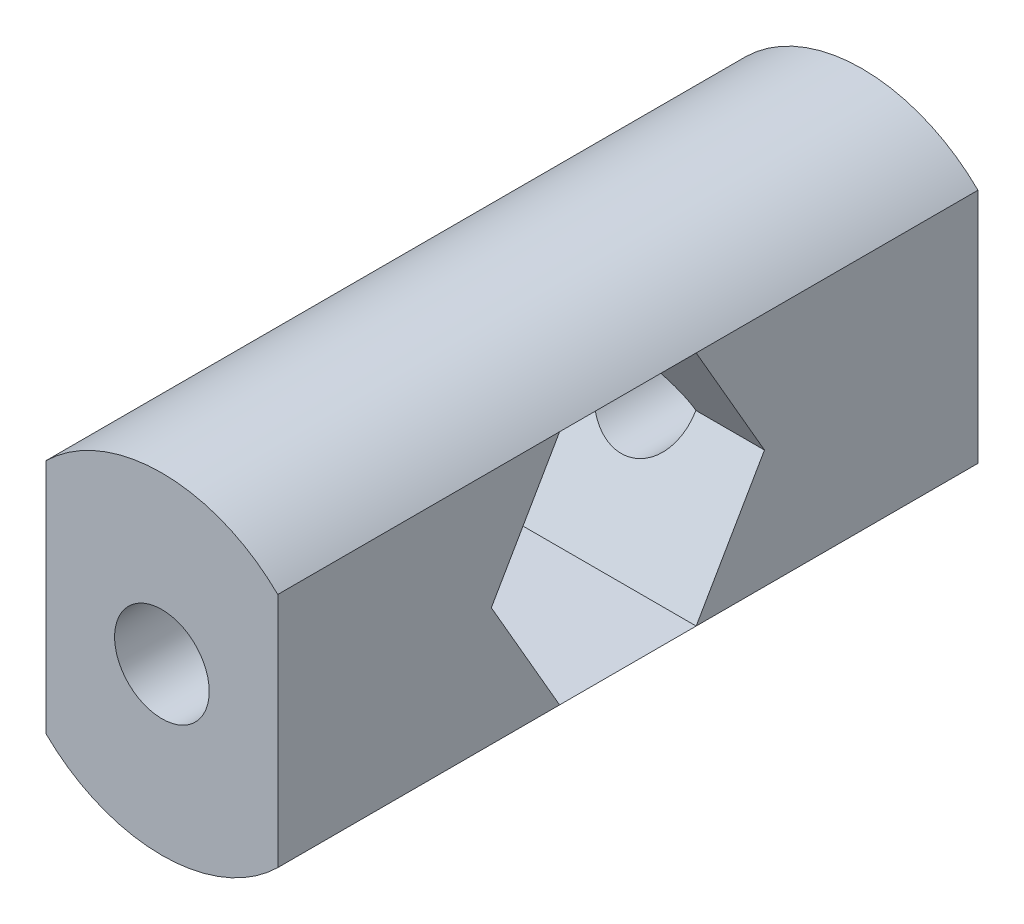
from build123d import *

# Parameters (mm, degrees)
SKETCH1_R           = 17.5
BOSS_EXTRUDE1_DEPTH = 37
SKETCH3_W           = 21.176447949
SKETCH3_H           = 25
CUT_EXTRUDE1_DEPTH  = 74
SKETCH4_R           = 5
CUT_EXTRUDE2_DEPTH  = 74
CUT_EXTRUDE3_DEPTH  = 74


with BuildPart() as part:
    # Sketch1 → Boss-Extrude1 (new, symmetric)
    with BuildSketch(Plane.XY):
        Circle(SKETCH1_R)
    extrude(amount=BOSS_EXTRUDE1_DEPTH, both=True)

    # Sketch3 → Cut-Extrude1 (cut)
    with BuildSketch(Plane.XY.offset(37)):
        with Locations((-22.835672689, 0)):
            Rectangle(SKETCH3_W, SKETCH3_H)
        with Locations((22.835672689, 0)):
            Rectangle(SKETCH3_W, SKETCH3_H)
    extrude(amount=-CUT_EXTRUDE1_DEPTH, mode=Mode.SUBTRACT)

    # Sketch4 → Cut-Extrude2 (cut)
    with BuildSketch(Plane.XY.offset(37)):
        Circle(SKETCH4_R)
    extrude(amount=-CUT_EXTRUDE2_DEPTH, mode=Mode.SUBTRACT)

    # Sketch5 → Cut-Extrude3 (cut)
    with BuildSketch(Plane(origin=(12.247448714, 0, 0), x_dir=(0, 0, -1), z_dir=(1, 0, 0))):
        Polygon((14.43375673, 0), (7.216878365, 12.5), (-7.216878365, 12.5), (-14.43375673, 0), (-7.216878365, -12.5), (7.216878365, -12.5), align=None)
    extrude(amount=-CUT_EXTRUDE3_DEPTH, mode=Mode.SUBTRACT)


solid = part.part
